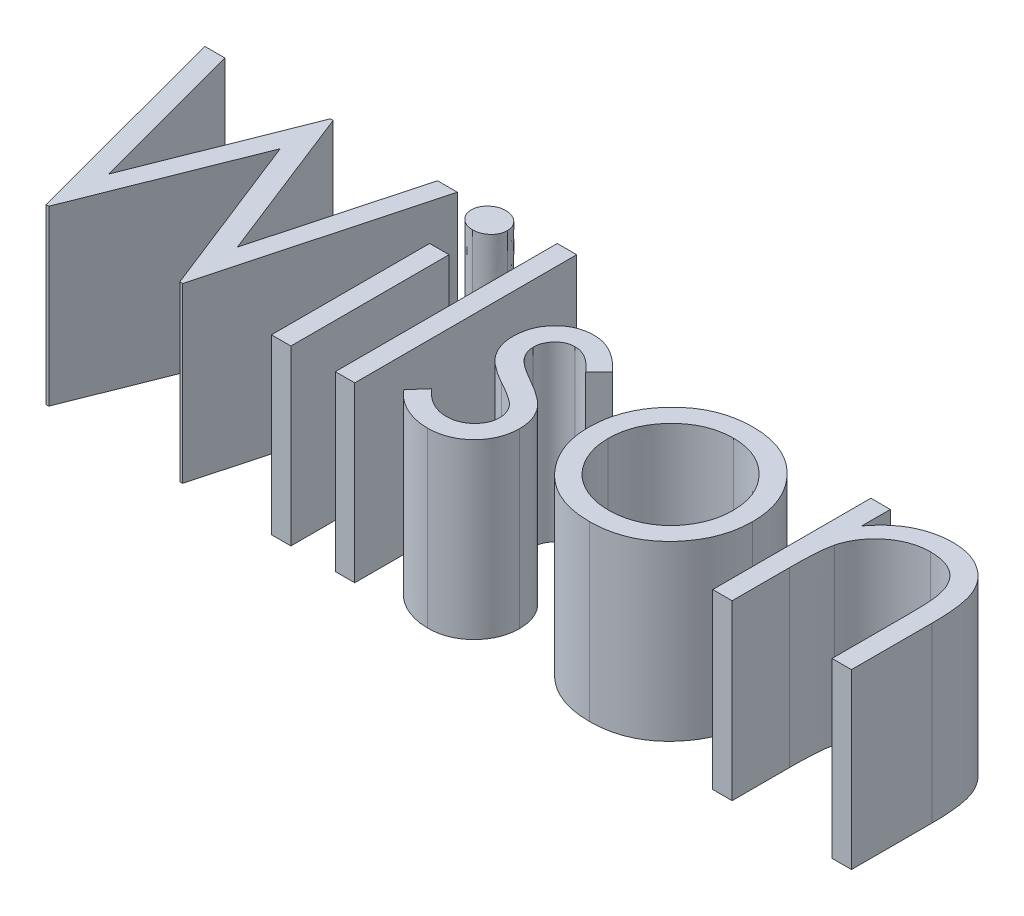
from build123d import *

# Parameters (mm, degrees)
BOSS_EXTRUDE1_DEPTH   = 2.54
BOSS_EXTRUDE1_2_DEPTH = 2.54
SKETCH1_W             = 0.284935897
SKETCH1_H             = 2.320192308
BOSS_EXTRUDE1_3_DEPTH = 2.54
SKETCH1_H_2           = 3.256410256
BOSS_EXTRUDE1_4_DEPTH = 2.54
BOSS_EXTRUDE1_5_DEPTH = 2.54
BOSS_EXTRUDE1_6_DEPTH = 2.54
BOSS_EXTRUDE1_7_DEPTH = 2.54


with BuildPart() as part:
    # Sketch1 → Boss-Extrude1 (new body)
    with BuildSketch(Plane(origin=(0, 0, 0), x_dir=(1, 0, 0), z_dir=(0, 1, 0))):
        Polygon((0.203525641, 3.175), (0.498001803, 3.175), (1.119391026, 0.846539463), (2.043524639, 3.175), (2.084865785, 3.175), (2.991826923, 0.862439904), (3.616396234, 3.175), (3.907692308, 3.175), (3.05161258, 0), (3.010907452, 0), (2.055608974, 2.428315304), (1.088862179, 0), (1.048157051, 0), align=None)
    extrude(amount=BOSS_EXTRUDE1_DEPTH)


with BuildPart() as body_2:
    # Sketch1 → Boss-Extrude1 2 (new body)
    with BuildSketch(Plane(origin=(0, 0, 0), x_dir=(1, 0, 0), z_dir=(0, 1, 0))):
        with BuildLine():
            add(Edge.make_bspline(
                [(4.496644631, 3.297115385), (4.514326039, 3.296295189), (4.548949632, 3.294689089), (4.59901781, 3.280935463), (4.6446081, 3.257622177), (4.685046472, 3.226344181), (4.719746398, 3.189560043), (4.744040328, 3.146687593), (4.75965443, 3.100370114), (4.761539977, 3.06806214), (4.7625, 3.05161258)],
                knots=[0, 0, 0, 0, 1.055194115, 2.066272739, 3.074728998, 4.095836921, 5.109056067, 6.073838105, 7.019297344, 8, 8, 8, 8], degree=3))
            add(Edge.make_bspline(
                [(4.7625, 3.05161258), (4.761518326, 3.03559003), (4.759577674, 3.003915346), (4.744052388, 2.958400839), (4.719539358, 2.916124096), (4.685068723, 2.879411381), (4.644602204, 2.848150675), (4.599019377, 2.824832805), (4.54894922, 2.811080395), (4.5143259, 2.809474127), (4.496644631, 2.808653846)],
                knots=[0, 0, 0, 0, 0.96129708, 1.900370562, 2.859976407, 3.87933698, 4.906634145, 5.921202961, 6.938410037, 8, 8, 8, 8], degree=3))
            add(Edge.make_bspline(
                [(4.496644631, 2.808653846), (4.479165553, 2.809442807), (4.445144811, 2.810978415), (4.395826319, 2.825102646), (4.35062476, 2.848158655), (4.310107522, 2.879206694), (4.276334418, 2.916349565), (4.251752365, 2.958375039), (4.236262936, 3.003921915), (4.234317451, 3.035592237), (4.233333333, 3.05161258)],
                knots=[0, 0, 0, 0, 1.054934014, 2.053291228, 3.073705704, 4.106921865, 5.123545215, 6.088680038, 7.033164197, 8, 8, 8, 8], degree=3))
            add(Edge.make_bspline(
                [(4.233333333, 3.05161258), (4.23429589, 3.068059851), (4.236186413, 3.100363328), (4.251763976, 3.146713822), (4.276129659, 3.189332756), (4.310129884, 3.226548745), (4.350618809, 3.257614247), (4.395827856, 3.280665637), (4.445144405, 3.294791066), (4.479165415, 3.296326509), (4.496644631, 3.297115385)],
                knots=[0, 0, 0, 0, 0.98631895, 1.937192651, 2.907499808, 3.917963147, 4.944918757, 5.95915025, 6.951458133, 8, 8, 8, 8], degree=3))
        make_face()
    extrude(amount=BOSS_EXTRUDE1_2_DEPTH)


with BuildPart() as body_3:
    # Sketch1 → Boss-Extrude1 3 (new body)
    with BuildSketch(Plane(origin=(0, 0, 0), x_dir=(1, 0, 0), z_dir=(0, 1, 0))):
        with Locations((4.497916667, 1.160096154)):
            Rectangle(SKETCH1_W, SKETCH1_H)
    extrude(amount=BOSS_EXTRUDE1_3_DEPTH)


with BuildPart() as body_4:
    # Sketch1 → Boss-Extrude1 4 (new body)
    with BuildSketch(Plane(origin=(0, 0, 0), x_dir=(1, 0, 0), z_dir=(0, 1, 0))):
        with Locations((5.434134616, 1.628205128)):
            Rectangle(SKETCH1_W, SKETCH1_H_2)
    extrude(amount=BOSS_EXTRUDE1_4_DEPTH)


with BuildPart() as body_5:
    # Sketch1 → Boss-Extrude1 5 (new body)
    with BuildSketch(Plane(origin=(0, 0, 0), x_dir=(1, 0, 0), z_dir=(0, 1, 0))):
        with BuildLine():
            Line((7.326923077, 2.030804287), (7.133573718, 1.831730769))
            add(Edge.make_bspline(
                [(7.133573718, 1.831730769), (7.116890904, 1.851064838), (7.084728403, 1.888338646), (7.033718416, 1.938174413), (6.982897005, 1.980027208), (6.932959867, 2.015362471), (6.882651294, 2.042077054), (6.832561661, 2.061575965), (6.782639105, 2.073642603), (6.749268916, 2.075197843), (6.732882612, 2.075961538)],
                knots=[0, 0, 0, 0, 1.26578478, 2.440284043, 3.530471711, 4.527705817, 5.468200915, 6.346673037, 7.188140097, 8, 8, 8, 8], degree=3))
            add(Edge.make_bspline(
                [(6.732882612, 2.075961538), (6.712799023, 2.074986475), (6.673277361, 2.073067688), (6.616648226, 2.053914791), (6.564078731, 2.024515435), (6.518579184, 1.982815363), (6.480036789, 1.934950634), (6.45190295, 1.881432539), (6.434698093, 1.823876099), (6.432516658, 1.783934728), (6.431410256, 1.763676883)],
                knots=[0, 0, 0, 0, 0.99966794, 1.967205029, 2.953328237, 3.988086729, 5.028030931, 6.008226631, 6.989793394, 8, 8, 8, 8], degree=3))
            add(Edge.make_bspline(
                [(6.431410256, 1.763676883), (6.432417922, 1.745341672), (6.434430412, 1.708722935), (6.450075614, 1.654704362), (6.474991265, 1.602038334), (6.498277798, 1.569777698), (6.510276442, 1.553155048)],
                knots=[0, 0, 0, 0, 0.960159726, 1.917612774, 2.927026955, 4, 4, 4, 4], degree=3))
            add(Edge.make_bspline(
                [(6.510276442, 1.553155048), (6.517500469, 1.544279032), (6.532875899, 1.525387551), (6.561730766, 1.499167627), (6.594408322, 1.470191442), (6.633705694, 1.441220169), (6.677929841, 1.41071139), (6.728039763, 1.379866597), (6.782445207, 1.346334583), (6.821395478, 1.325067131), (6.841641627, 1.31401242)],
                knots=[0, 0, 0, 0, 0.66740084, 1.420478572, 2.27185888, 3.217733974, 4.268547843, 5.408967954, 6.65319498, 8, 8, 8, 8], degree=3))
            add(Edge.make_bspline(
                [(6.841641627, 1.31401242), (6.866328229, 1.300183115), (6.914014615, 1.273469452), (6.981771625, 1.232004221), (7.043264155, 1.190791429), (7.099013225, 1.150271831), (7.147946152, 1.109311729), (7.191547568, 1.069481121), (7.228729942, 1.029576534), (7.249552432, 1.00169721), (7.259505208, 0.988371394)],
                knots=[0, 0, 0, 0, 1.27191281, 2.456916733, 3.569705269, 4.599008579, 5.553216877, 6.436649441, 7.252746552, 8, 8, 8, 8], degree=3))
            add(Edge.make_bspline(
                [(7.259505208, 0.988371394), (7.276024758, 0.961460014), (7.308901728, 0.907901374), (7.343426013, 0.819710372), (7.363437834, 0.726174416), (7.366215705, 0.662191616), (7.367628205, 0.629657452)],
                knots=[0, 0, 0, 0, 0.995354457, 1.980940102, 2.973342416, 4, 4, 4, 4], degree=3))
            add(Edge.make_bspline(
                [(7.367628205, 0.629657452), (7.366975485, 0.606734726), (7.365689229, 0.561562992), (7.356746554, 0.495037825), (7.341365969, 0.431415762), (7.320416635, 0.370006468), (7.292127953, 0.311986573), (7.25897388, 0.255892261), (7.219173068, 0.202936952), (7.173733034, 0.153190181), (7.123980336, 0.107755253), (7.07090691, 0.067819238), (7.0144474, 0.034641089), (6.95500523, 0.007186098), (6.892445344, -0.014647251), (6.82675796, -0.029762547), (6.758151875, -0.038809266), (6.711497692, -0.040065184), (6.687725361, -0.040705128)],
                knots=[0, 0, 0, 0, 1.032770009, 2.035186124, 3.017557409, 3.978232242, 4.952395191, 5.920591857, 6.910227898, 7.931268572, 8.952309245, 9.941945286, 10.918353717, 11.897095711, 12.887975737, 13.898235213, 14.929059601, 16, 16, 16, 16], degree=3))
            add(Edge.make_bspline(
                [(6.687725361, -0.040705128), (6.65564228, -0.039804607), (6.591921911, -0.038016078), (6.497679094, -0.021228437), (6.405585263, 0.004893099), (6.316337337, 0.040921125), (6.231931219, 0.086414986), (6.154705309, 0.140900158), (6.08439134, 0.202576798), (6.044369763, 0.249850653), (6.024358974, 0.27348758)],
                knots=[0, 0, 0, 0, 1.013940152, 2.01379169, 3.017749504, 4.037548394, 5.051665909, 6.043208538, 7.021604269, 8, 8, 8, 8], degree=3))
            Line((6.024358974, 0.27348758), (6.21325621, 0.488461538))
            add(Edge.make_bspline(
                [(6.21325621, 0.488461538), (6.231192613, 0.469089716), (6.265965043, 0.43153451), (6.321574004, 0.381528858), (6.378161032, 0.339617705), (6.435161069, 0.304562607), (6.493417869, 0.277552063), (6.552604962, 0.25857591), (6.612601961, 0.246380107), (6.652899184, 0.24494838), (6.673096955, 0.244230769)],
                knots=[0, 0, 0, 0, 1.179806542, 2.287233372, 3.337373186, 4.324005949, 5.273901747, 6.200048787, 7.097828587, 8, 8, 8, 8], degree=3))
            add(Edge.make_bspline(
                [(6.673096955, 0.244230769), (6.700599645, 0.245474303), (6.754335288, 0.24790396), (6.831300697, 0.269963036), (6.902365023, 0.30455235), (6.964071915, 0.353614897), (7.016597447, 0.410724595), (7.054632291, 0.475053832), (7.078468535, 0.544714654), (7.081267977, 0.593003957), (7.082692308, 0.617573117)],
                knots=[0, 0, 0, 0, 1.072336372, 2.095165389, 3.102688358, 4.141489647, 5.156069229, 6.117746104, 7.042326257, 8, 8, 8, 8], degree=3))
            add(Edge.make_bspline(
                [(7.082692308, 0.617573117), (7.081706884, 0.637811128), (7.079761295, 0.677768372), (7.064482042, 0.735599039), (7.040340383, 0.790453315), (7.016569023, 0.822556781), (7.004462139, 0.838907252)],
                knots=[0, 0, 0, 0, 1.013901739, 2.00181326, 2.98231254, 4, 4, 4, 4], degree=3))
            add(Edge.make_bspline(
                [(7.004462139, 0.838907252), (6.997184682, 0.847103616), (6.98133175, 0.864958257), (6.952253067, 0.890743865), (6.917435235, 0.918536997), (6.876486659, 0.947866367), (6.829324789, 0.978345102), (6.77575848, 1.0098133), (6.71652155, 1.043765594), (6.674638191, 1.066280567), (6.652744391, 1.07804988)],
                knots=[0, 0, 0, 0, 0.615000592, 1.339693406, 2.178160186, 3.116406724, 4.166410947, 5.330106347, 6.604359322, 8, 8, 8, 8], degree=3))
            add(Edge.make_bspline(
                [(6.652744391, 1.07804988), (6.629116368, 1.091238949), (6.583294089, 1.116816764), (6.518390476, 1.156654923), (6.459836804, 1.197174522), (6.40622414, 1.236102597), (6.358906656, 1.275491596), (6.31807076, 1.315385246), (6.2821087, 1.354174662), (6.262199263, 1.381658638), (6.252689303, 1.394786659)],
                knots=[0, 0, 0, 0, 1.262093308, 2.447601706, 3.550203992, 4.582594899, 5.537233252, 6.418365656, 7.244515135, 8, 8, 8, 8], degree=3))
            add(Edge.make_bspline(
                [(6.252689303, 1.394786659), (6.236242259, 1.421225895), (6.203342423, 1.474113608), (6.171397214, 1.562388111), (6.149438888, 1.655320413), (6.147477291, 1.719443488), (6.146474359, 1.752228566)],
                knots=[0, 0, 0, 0, 0.985009483, 1.970363186, 2.962279964, 4, 4, 4, 4], degree=3))
            add(Edge.make_bspline(
                [(6.146474359, 1.752228566), (6.14695895, 1.773660177), (6.147907365, 1.815604876), (6.155476611, 1.877235091), (6.169257664, 1.935789488), (6.186543201, 1.992147428), (6.210567069, 2.045217185), (6.239274426, 2.095706462), (6.273008733, 2.143545473), (6.311873718, 2.187998315), (6.354606175, 2.228374632), (6.400775002, 2.26357053), (6.449341849, 2.293602724), (6.500512343, 2.318789691), (6.554778058, 2.337840945), (6.61175968, 2.350955859), (6.671341871, 2.359714507), (6.712073606, 2.360497448), (6.732882612, 2.360897436)],
                knots=[0, 0, 0, 0, 1.087655834, 2.128696564, 3.144119009, 4.137814668, 5.115653402, 6.093965665, 7.082169637, 8.081268856, 9.086088321, 10.061021666, 11.022561449, 11.980240094, 12.950172527, 13.934149372, 14.944599409, 16, 16, 16, 16], degree=3))
            add(Edge.make_bspline(
                [(6.732882612, 2.360897436), (6.757549698, 2.359895641), (6.8073466, 2.357873259), (6.88205401, 2.341811668), (6.956651399, 2.315383781), (7.031330438, 2.278883769), (7.105544058, 2.231651675), (7.179945063, 2.17456581), (7.255426634, 2.108001741), (7.302558432, 2.057111729), (7.326923077, 2.030804287)],
                knots=[0, 0, 0, 0, 0.845714091, 1.707292901, 2.609013841, 3.555613372, 4.552488639, 5.621697636, 6.770543573, 8, 8, 8, 8], degree=3))
        make_face()
    extrude(amount=BOSS_EXTRUDE1_5_DEPTH)


with BuildPart() as body_6:
    # Sketch1 → Boss-Extrude1 6 (new body)
    with BuildSketch(Plane(origin=(0, 0, 0), x_dir=(1, 0, 0), z_dir=(0, 1, 0))):
        with BuildLine():
            add(Edge.make_bspline(
                [(9.058163061, 2.360897436), (9.101698001, 2.359970435), (9.18705938, 2.358152812), (9.312070819, 2.338726379), (9.43140105, 2.309019841), (9.545507095, 2.267952067), (9.652927592, 2.212904869), (9.755227221, 2.147219298), (9.852125507, 2.069402231), (9.910203541, 2.009205983), (9.939683494, 1.978650841)],
                knots=[0, 0, 0, 0, 1.054011418, 2.066658804, 3.057071809, 4.030435133, 4.997543892, 5.974964718, 6.972108034, 8, 8, 8, 8], degree=3))
            add(Edge.make_bspline(
                [(9.939683494, 1.978650841), (9.965067123, 1.949428154), (10.01534314, 1.89154832), (10.079809899, 1.797699299), (10.1353466, 1.700507922), (10.179853715, 1.598683562), (10.214946557, 1.49311511), (10.239861868, 1.383439714), (10.254681801, 1.269899585), (10.256680207, 1.19278896), (10.257692308, 1.153735978)],
                knots=[0, 0, 0, 0, 1.025258237, 2.030674902, 3.01204498, 3.988269485, 4.97094183, 5.956517959, 6.965070386, 8, 8, 8, 8], degree=3))
            add(Edge.make_bspline(
                [(10.257692308, 1.153735978), (10.256802095, 1.11445664), (10.255042992, 1.036838836), (10.238402711, 0.922521268), (10.212520941, 0.811673108), (10.17548063, 0.704758435), (10.127984345, 0.601450442), (10.070026365, 0.502200351), (10.001199969, 0.406812344), (9.923182058, 0.316096391), (9.836956427, 0.232488468), (9.74341535, 0.159619252), (9.644397048, 0.097188297), (9.538584863, 0.046899549), (9.426945071, 0.007248606), (9.309236874, -0.020600694), (9.185643131, -0.037438793), (9.101254152, -0.039601034), (9.058163061, -0.040705128)],
                knots=[0, 0, 0, 0, 0.998656419, 1.973391657, 2.932242238, 3.890759089, 4.846373663, 5.82037756, 6.809684879, 7.83454468, 8.860553229, 9.859544525, 10.845671541, 11.83227036, 12.833544569, 13.85385346, 14.904124723, 16, 16, 16, 16], degree=3))
            add(Edge.make_bspline(
                [(9.058163061, -0.040705128), (9.014860851, -0.039597329), (8.930051285, -0.037427648), (8.806021288, -0.020666113), (8.688102133, 0.007235772), (8.57631619, 0.047029854), (8.470049079, 0.097189905), (8.370457043, 0.159430509), (8.276839976, 0.232510078), (8.190596105, 0.316090535), (8.112583084, 0.406813853), (8.043755427, 0.502199959), (7.985797774, 0.601450544), (7.938301403, 0.704758408), (7.901261116, 0.811673115), (7.875379339, 0.922521266), (7.85873906, 1.036838836), (7.856979957, 1.11445664), (7.856089744, 1.153735978)],
                knots=[0, 0, 0, 0, 1.099876186, 2.154163076, 3.173186993, 4.173200201, 5.163417411, 6.152872554, 7.150605724, 8.17532212, 9.198891216, 10.186952605, 11.159729845, 12.11414092, 13.071450619, 14.029093627, 15.002601286, 16, 16, 16, 16], degree=3))
            add(Edge.make_bspline(
                [(7.856089744, 1.153735978), (7.857108747, 1.192576701), (7.859126197, 1.269474659), (7.873931231, 1.38280135), (7.89874935, 1.492291124), (7.933884259, 1.597452092), (7.978801611, 1.698830237), (8.033557922, 1.796261763), (8.098682282, 1.88968641), (8.148758338, 1.94749144), (8.174098558, 1.976742788)],
                knots=[0, 0, 0, 0, 1.031353054, 2.041901799, 3.029428768, 4.008703097, 4.981709435, 5.96992636, 6.972712378, 8, 8, 8, 8], degree=3))
            add(Edge.make_bspline(
                [(8.174098558, 1.976742788), (8.203534065, 2.007562912), (8.26142417, 2.068176108), (8.358804802, 2.145766326), (8.460852768, 2.212818764), (8.56946038, 2.266772189), (8.683472687, 2.309261415), (8.803414428, 2.33880299), (8.928850074, 2.358082819), (9.014629159, 2.35994988), (9.058163061, 2.360897436)],
                knots=[0, 0, 0, 0, 1.027980169, 2.021703884, 2.998553061, 3.971491411, 4.943284454, 5.930300938, 6.949603206, 8, 8, 8, 8], degree=3))
        make_face()
        with BuildLine():
            add(Edge.make_bspline(
                [(9.056891026, 2.075961538), (9.026104764, 2.075086516), (8.965326983, 2.07335906), (8.875864931, 2.060220089), (8.789740649, 2.039403425), (8.70679074, 2.009826888), (8.627294934, 1.971637172), (8.551177119, 1.924730303), (8.478213405, 1.869727549), (8.409831105, 1.806714983), (8.347072865, 1.737881895), (8.2922107, 1.664540884), (8.245560782, 1.587881555), (8.206698638, 1.507824192), (8.17775426, 1.423557503), (8.156733018, 1.336035787), (8.143606443, 1.245080731), (8.141895228, 1.18324895), (8.141025641, 1.151827925)],
                knots=[0, 0, 0, 0, 1.021534396, 2.016698045, 2.994645724, 3.958388632, 4.93408049, 5.916473867, 6.921342795, 7.962252576, 8.998418191, 10.008913653, 10.997312074, 11.973003931, 12.956656626, 13.948281152, 14.957379055, 16, 16, 16, 16], degree=3))
            add(Edge.make_bspline(
                [(8.141025641, 1.151827925), (8.14248326, 1.111231443), (8.14537636, 1.030655018), (8.168903324, 0.911990642), (8.208260878, 0.798069962), (8.261407911, 0.689560812), (8.327997838, 0.589165246), (8.406453962, 0.499656113), (8.495934262, 0.422380413), (8.595372087, 0.358262789), (8.702736361, 0.307317867), (8.816361738, 0.271214511), (8.934871511, 0.24774519), (9.015861888, 0.245412495), (9.056891026, 0.244230769)],
                knots=[0, 0, 0, 0, 1.016792936, 2.018143844, 3.017858371, 4.030088057, 5.03801393, 6.028138512, 7.003788237, 7.991172063, 8.984598303, 9.972568034, 10.972917682, 12, 12, 12, 12], degree=3))
            add(Edge.make_bspline(
                [(9.056891026, 0.244230769), (9.097917803, 0.245419381), (9.178903522, 0.247765666), (9.297248633, 0.27109631), (9.41056345, 0.307476059), (9.517816209, 0.358205493), (9.61720877, 0.422623898), (9.707332616, 0.499219754), (9.785118856, 0.589402319), (9.851642912, 0.689693792), (9.905660315, 0.79790174), (9.944833648, 0.912011668), (9.968417172, 1.030649663), (9.971302638, 1.111229649), (9.97275641, 1.151827925)],
                knots=[0, 0, 0, 0, 1.02726834, 2.027799167, 3.010890988, 4.004497153, 4.992059811, 5.971914811, 6.958719428, 7.966827853, 8.981595046, 9.981490638, 10.983022906, 12, 12, 12, 12], degree=3))
            add(Edge.make_bspline(
                [(9.97275641, 1.151827925), (9.971887122, 1.183249138), (9.970176497, 1.245081288), (9.957045636, 1.336033657), (9.936040254, 1.423565319), (9.90703743, 1.507795351), (9.868344146, 1.588088837), (9.820794626, 1.664315804), (9.766156482, 1.738135956), (9.702640951, 1.806492473), (9.634330029, 1.869752114), (9.561336745, 1.924751631), (9.4853318, 1.971431021), (9.406066943, 2.01015354), (9.323106399, 2.039134341), (9.237102789, 2.060340285), (9.14802244, 2.073303535), (9.087462451, 2.075069871), (9.056891026, 2.075961538)],
                knots=[0, 0, 0, 0, 1.042956736, 2.052379634, 3.044323526, 4.02829302, 5.004299113, 5.996692471, 7.007513377, 8.048758398, 9.090003419, 10.095195979, 11.07790575, 12.047570684, 13.018257071, 13.989683339, 14.985167495, 16, 16, 16, 16], degree=3))
        make_face(mode=Mode.SUBTRACT)
    extrude(amount=BOSS_EXTRUDE1_6_DEPTH)


with BuildPart() as body_7:
    # Sketch1 → Boss-Extrude1 7 (new body)
    with BuildSketch(Plane(origin=(0, 0, 0), x_dir=(1, 0, 0), z_dir=(0, 1, 0))):
        with BuildLine():
            Line((10.827564103, 2.320192308), (11.1125, 2.320192308))
            Line((11.1125, 2.320192308), (11.1125, 1.901692708))
            add(Edge.make_bspline(
                [(11.1125, 1.901692708), (11.142923426, 1.939650035), (11.201961146, 2.013307553), (11.30028122, 2.11011836), (11.404188901, 2.189897243), (11.513047861, 2.253491399), (11.627005877, 2.301430838), (11.745368308, 2.33605279), (11.868843791, 2.356812599), (11.952812959, 2.359525165), (11.995292468, 2.360897436)],
                knots=[0, 0, 0, 0, 1.12780773, 2.188550248, 3.19190651, 4.159438251, 5.104880172, 6.052711206, 7.014878035, 8, 8, 8, 8], degree=3))
            add(Edge.make_bspline(
                [(11.995292468, 2.360897436), (12.038228115, 2.359314294), (12.122263532, 2.356215704), (12.244617202, 2.331707706), (12.358893066, 2.289847367), (12.464683663, 2.232504989), (12.560049064, 2.161197688), (12.643800893, 2.078123558), (12.713073268, 1.982568682), (12.75951659, 1.893919819), (12.79011057, 1.815280699), (12.809371334, 1.74792829), (12.82572801, 1.67289111), (12.839908238, 1.590395911), (12.84950319, 1.499864696), (12.85707084, 1.401668575), (12.86249437, 1.295839357), (12.86270955, 1.222645059), (12.862820513, 1.184900841)],
                knots=[0, 0, 0, 0, 1.235846778, 2.418850247, 3.575807741, 4.728682307, 5.871620074, 6.994088408, 8.11269785, 9.256955736, 9.865816715, 10.540099792, 11.271859618, 12.076849838, 12.949306005, 13.892391288, 14.913166135, 16, 16, 16, 16], degree=3))
            Line((12.862820513, 1.184900841), (12.862820513, 0))
            Line((12.862820513, 0), (12.577884615, 0))
            Line((12.577884615, 0), (12.577884615, 1.09140625))
            add(Edge.make_bspline(
                [(12.577884615, 1.09140625), (12.577709348, 1.122995182), (12.577374092, 1.183419433), (12.576316684, 1.269932762), (12.573767788, 1.348388443), (12.570186104, 1.418598912), (12.564943697, 1.48049675), (12.55948031, 1.534208022), (12.552799224, 1.579664536), (12.546845725, 1.607028575), (12.544175681, 1.619300881)],
                knots=[0, 0, 0, 0, 1.430800155, 2.736877192, 3.918605307, 4.986035426, 5.920637409, 6.731861385, 7.431261377, 8, 8, 8, 8], degree=3))
            add(Edge.make_bspline(
                [(12.544175681, 1.619300881), (12.534536806, 1.655324599), (12.515984954, 1.72465911), (12.470143412, 1.818706559), (12.412254834, 1.898714915), (12.341590356, 1.964189512), (12.258832552, 2.015144486), (12.164211072, 2.05049943), (12.05863902, 2.072612189), (11.984385401, 2.074813944), (11.945683093, 2.075961538)],
                knots=[0, 0, 0, 0, 1.084156227, 2.086665306, 3.027808233, 3.945421172, 4.874247719, 5.839848303, 6.874090471, 8, 8, 8, 8], degree=3))
            add(Edge.make_bspline(
                [(11.945683093, 2.075961538), (11.922761694, 2.075529734), (11.877400838, 2.074675205), (11.810136221, 2.066101527), (11.744890721, 2.0520785), (11.681009532, 2.033147664), (11.619770319, 2.007146892), (11.559205569, 1.977638106), (11.501595861, 1.940855085), (11.44571278, 1.899860735), (11.393721876, 1.85443174), (11.345345454, 1.80649422), (11.302221679, 1.755444208), (11.263152238, 1.702104256), (11.229426242, 1.645741803), (11.199986655, 1.586900611), (11.175007846, 1.525503233), (11.162595689, 1.482890141), (11.156385216, 1.46156851)],
                knots=[0, 0, 0, 0, 1.023777757, 2.026029729, 3.023749952, 4.003683103, 4.997618607, 5.993177895, 7.010360494, 8.046726602, 9.087585522, 10.09234134, 11.086953743, 12.070360549, 13.043493632, 14.017870808, 15.008233677, 16, 16, 16, 16], degree=3))
            add(Edge.make_bspline(
                [(11.156385216, 1.46156851), (11.152811392, 1.445915575), (11.145031364, 1.411839956), (11.136628337, 1.355919662), (11.129001465, 1.291231327), (11.122617938, 1.21785044), (11.11871231, 1.135520082), (11.114453822, 1.044591857), (11.112903459, 0.944703193), (11.112638252, 0.875160086), (11.1125, 0.838907252)],
                knots=[0, 0, 0, 0, 0.615963638, 1.340920617, 2.168419149, 3.115676021, 4.16674242, 5.331190069, 6.6087489, 8, 8, 8, 8], degree=3))
            Line((11.1125, 0.838907252), (11.1125, 0))
            Line((11.1125, 0), (10.827564103, 0))
            Line((10.827564103, 0), (10.827564103, 2.320192308))
        make_face()
    extrude(amount=BOSS_EXTRUDE1_7_DEPTH)


solid = Compound([part.part, body_2.part, body_3.part, body_4.part, body_5.part, body_6.part, body_7.part])
